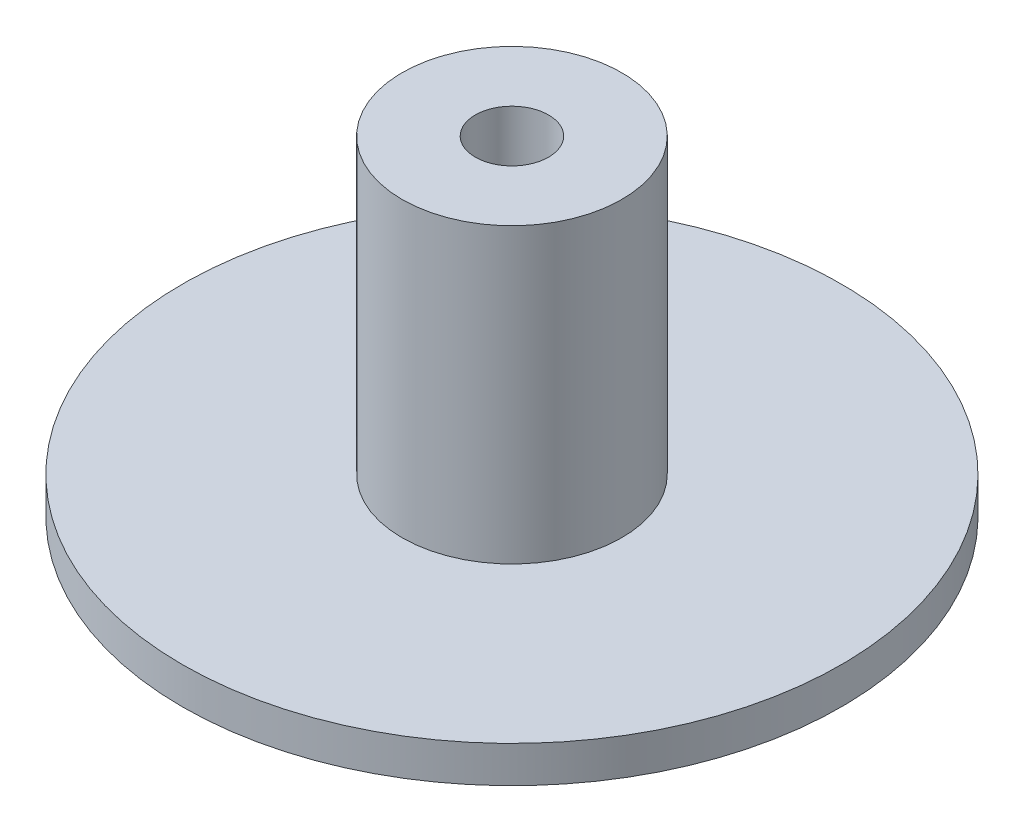
from build123d import *

# Parameters (mm, degrees)
SKETCH2_W           = 57.15
SKETCH2_H           = 6.35
SKETCH3_R           = 19.05
BOSS_EXTRUDE1_DEPTH = 50.8
SKETCH4_R           = 6.35
CUT_EXTRUDE1_DEPTH  = 81.026


with BuildPart() as part:
    # Sketch2 → Revolve1 (revolve)
    with BuildSketch(Plane.XY, mode=Mode.PRIVATE) as revolve1_sk:
        with Locations((28.575, -3.175)):
            Rectangle(SKETCH2_W, SKETCH2_H)
    revolve(revolve1_sk.sketch.rotate(Axis((0, 0, 0), (0, -1, 0)), 90), axis=Axis((0, 0, 0), (0, -1, 0)))

    # Sketch3 → Boss-Extrude1 (add)
    with BuildSketch(Plane(origin=(0, 0, 0), x_dir=(1, 0, 0), z_dir=(0, 1, 0))):
        with Locations(Location((0, 0, 0), (0, 0, 270))):
            Circle(SKETCH3_R)
    extrude(amount=BOSS_EXTRUDE1_DEPTH)

    # Sketch4 → Cut-Extrude1 (cut)
    with BuildSketch(Plane(origin=(0, 50.8, 0), x_dir=(1, 0, 0), z_dir=(0, 1, 0))):
        with Locations(Location((0, 0, 0), (0, 0, 270))):
            Circle(SKETCH4_R)
    extrude(amount=-CUT_EXTRUDE1_DEPTH, mode=Mode.SUBTRACT)


solid = part.part
